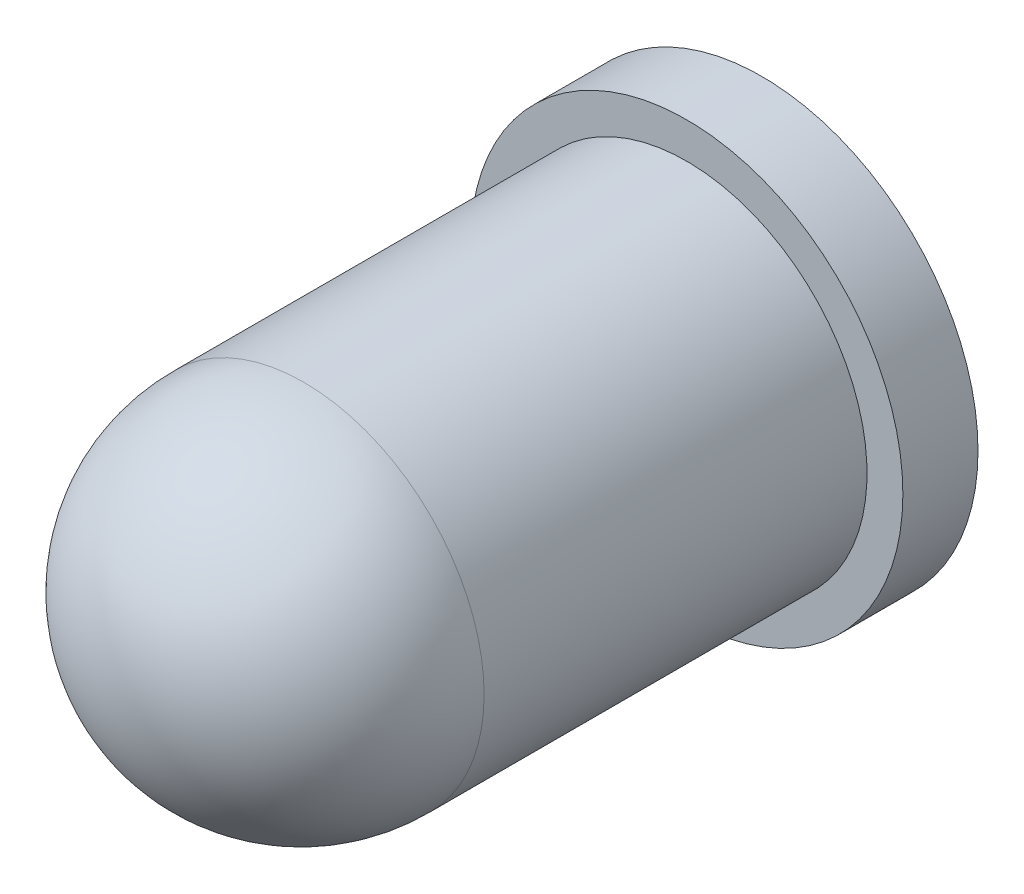
from build123d import *

# Parameters (mm, degrees)
SKETCH1_R           = 2.5
BOSS_EXTRUDE1_DEPTH = 6.35
DOME1_FACE_RADIUS   = 2.5
DOME1_HEIGHT        = 2.54
SKETCH3_R           = 2.9972
BOSS_EXTRUDE2_DEPTH = 1.0414


with BuildPart() as part:
    # Sketch1 → Boss-Extrude1 (new body)
    with BuildSketch(Plane.XY):
        Circle(SKETCH1_R)
    extrude(amount=BOSS_EXTRUDE1_DEPTH)

    # Dome1: a dome of height H over a round flat face of radius A is a cap of a sphere of radius (A * A + H * H) / (2 * H)
    dome1_r = (DOME1_FACE_RADIUS * DOME1_FACE_RADIUS + DOME1_HEIGHT * DOME1_HEIGHT) / (2 * DOME1_HEIGHT)
    dome1_base = Plane((0, 0, 6.35), z_dir=(0, 0, 1))
    with Locations(dome1_base.offset(DOME1_HEIGHT - dome1_r)):
        dome1_ball = Sphere(dome1_r, mode=Mode.PRIVATE)
    add(split(dome1_ball, bisect_by=dome1_base, keep=Keep.TOP, mode=Mode.PRIVATE))

    # Sketch3 → Boss-Extrude2 (add)
    with BuildSketch(Plane(origin=(0, 0, 0), x_dir=(-1, 0, 0), z_dir=(0, 0, -1))):
        Circle(SKETCH3_R)
    extrude(amount=-BOSS_EXTRUDE2_DEPTH)


solid = part.part
